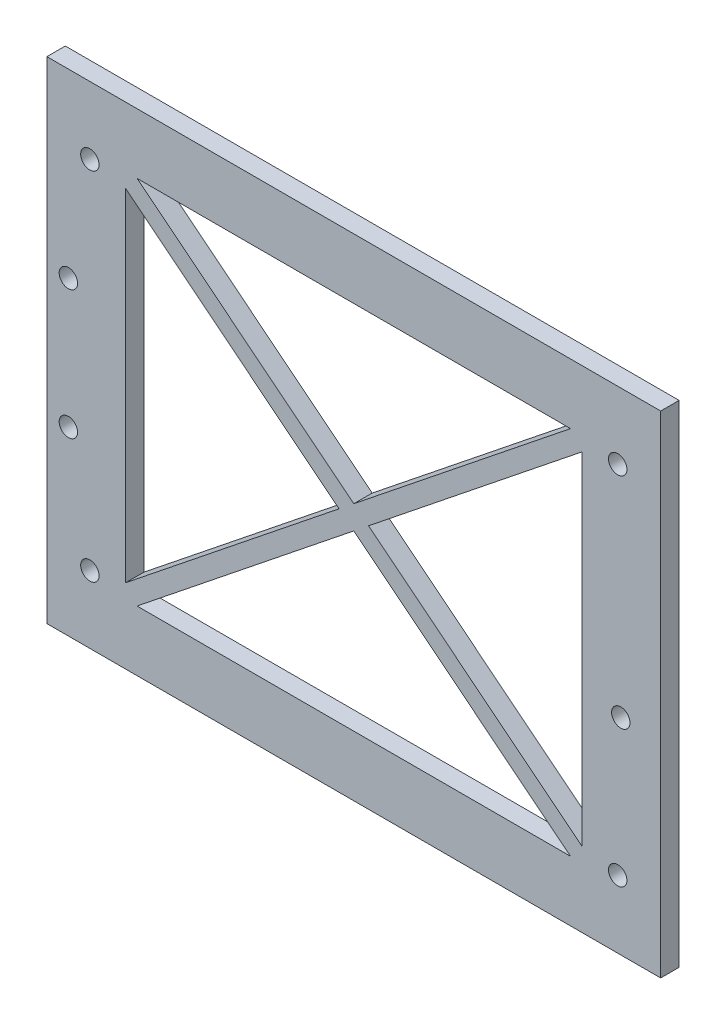
from build123d import *

# Parameters (mm, degrees)
EXTRUDE_2_DEPTH = 3
SKETCH_1_5_W    = 100
SKETCH_1_5_H    = 80
SKETCH_1_5_R    = 1.5
EXTRUDE_3_DEPTH = 3


with BuildPart() as part:
    # 草图1 → 凸台-拉伸2 (new body)
    with BuildSketch(Plane.XY):
        with BuildLine():
            Line((-35.312957429, 30.171303214), (0, 1.920937271))
            Line((0, 1.920937271), (35.312957429, 30.171303214))
            ThreePointArc((35.312957429, 30.171303214), (37.421303214, 29.937042571), (37.187042571, 27.828696786))
            Line((37.187042571, 27.828696786), (2.401171589, 0))
            Line((2.401171589, 0), (37.187042571, -27.828696786))
            ThreePointArc((37.187042571, -27.828696786), (37.421303214, -29.937042571), (35.312957429, -30.171303214))
            Line((35.312957429, -30.171303214), (0, -1.920937271))
            Line((0, -1.920937271), (-35.312957429, -30.171303214))
            ThreePointArc((-35.312957429, -30.171303214), (-37.421303214, -29.937042571), (-37.187042571, -27.828696786))
            Line((-37.187042571, -27.828696786), (-2.401171589, 0))
            Line((-2.401171589, 0), (-37.187042571, 27.828696786))
            ThreePointArc((-37.187042571, 27.828696786), (-37.421303214, 29.937042571), (-35.312957429, 30.171303214))
        make_face()
    extrude(amount=EXTRUDE_2_DEPTH)

    # 草图1<5> → 凸台-拉伸3 (add)
    with BuildSketch(Plane.XY):
        Rectangle(SKETCH_1_5_W, SKETCH_1_5_H)
        with Locations((-43, -29)):
            Circle(SKETCH_1_5_R, mode=Mode.SUBTRACT)
        with BuildLine():
            ThreePointArc((-45, -10.5), (-47.560660172, -11.560660172), (-46.5, -9))
            ThreePointArc((-46.5, -9), (-45.439339828, -9.439339828), (-45, -10.5))
        make_face(mode=Mode.SUBTRACT)
        with Locations((43, -29)):
            Circle(SKETCH_1_5_R, mode=Mode.SUBTRACT)
        with Locations((43.5, -6.5)):
            Circle(SKETCH_1_5_R, mode=Mode.SUBTRACT)
        with BuildLine():
            ThreePointArc((-45, 10.5), (-45.439339828, 9.439339828), (-46.5, 9))
            ThreePointArc((-46.5, 9), (-47.560660172, 11.560660172), (-45, 10.5))
        make_face(mode=Mode.SUBTRACT)
        with Locations((-43, 29)):
            Circle(SKETCH_1_5_R, mode=Mode.SUBTRACT)
        with BuildLine():
            ThreePointArc((-37.187042571, 27.828696786), (-37.421303214, 29.937042571), (-35.312957429, 30.171303214))
            Line((-35.312957429, 30.171303214), (35.312957429, 30.171303214))
            ThreePointArc((35.312957429, 30.171303214), (37.421303214, 29.937042571), (37.187042571, 27.828696786))
            Line((37.187042571, 27.828696786), (37.187042571, -27.828696786))
            ThreePointArc((37.187042571, -27.828696786), (37.421303214, -29.937042571), (35.312957429, -30.171303214))
            Line((35.312957429, -30.171303214), (-35.312957429, -30.171303214))
            ThreePointArc((-35.312957429, -30.171303214), (-37.421303214, -29.937042571), (-37.187042571, -27.828696786))
            Line((-37.187042571, -27.828696786), (-37.187042571, 27.828696786))
        make_face(mode=Mode.SUBTRACT)
        with Locations((43, 29)):
            Circle(SKETCH_1_5_R, mode=Mode.SUBTRACT)
    extrude(amount=EXTRUDE_3_DEPTH)


solid = part.part
